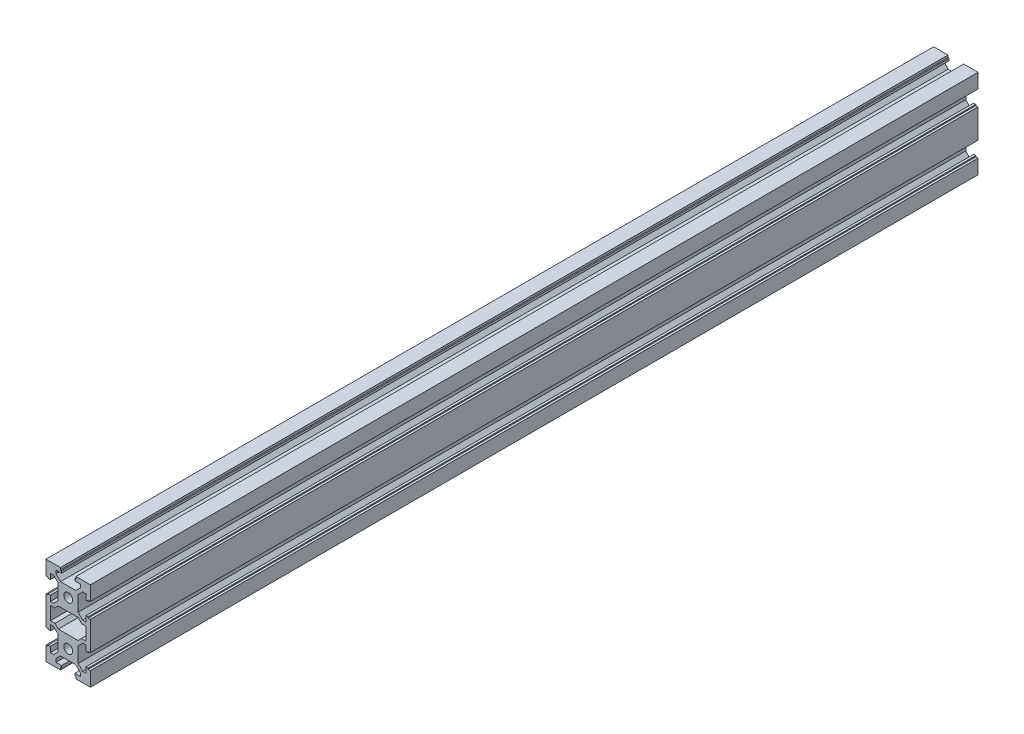
from build123d import *

# Parameters (mm, degrees)
SKETCH1_R           = 2
BOSS_EXTRUDE1_DEPTH = 400


with BuildPart() as part:
    # Sketch1 → Boss-Extrude1 (new body)
    with BuildSketch(Plane.XY):
        Polygon((-10, -20), (-3.5, -20), (-3.5, -19), (-3, -19), (-3, -18), (-5.5, -18), (-5.5, -16.560660172), (-3.44, -14.500660172), (3.44, -14.500660172), (5.5, -16.560660172), (5.5, -18), (3, -18), (3, -19), (3.5, -19), (3.5, -20), (10, -20), (10, -13.5), (9, -13.5), (9, -13), (8, -13), (8, -15.5), (6.560660172, -15.5), (4.500660172, -13.44), (4.500660172, -6.56), (6.560660172, -4.5), (8, -4.5), (8, -7), (9, -7), (9, -6.5), (10, -6.5), (10, 6.5), (9, 6.5), (9, 7), (8, 7), (8, 4.5), (6.560660172, 4.5), (4.500660172, 6.56), (4.500660172, 13.44), (6.560660172, 15.5), (8, 15.5), (8, 13), (9, 13), (9, 13.5), (10, 13.5), (10, 20), (3.5, 20), (3.5, 19), (3, 19), (3, 18), (5.5, 18), (5.5, 16.560660172), (3.44, 14.500660172), (-3.44, 14.500660172), (-5.5, 16.560660172), (-5.5, 18), (-3, 18), (-3, 19), (-3.5, 19), (-3.5, 20), (-10, 20), (-10, 13.5), (-9, 13.5), (-9, 13), (-8, 13), (-8, 15.5), (-6.560660172, 15.5), (-4.500660172, 13.44), (-4.500660172, 6.56), (-6.560660172, 4.5), (-8, 4.5), (-8, 7), (-9, 7), (-9, 6.5), (-10, 6.5), (-10, -6.5), (-9, -6.5), (-9, -7), (-8, -7), (-8, -4.5), (-6.560660172, -4.5), (-4.500660172, -6.56), (-4.500660172, -13.44), (-6.560660172, -15.5), (-8, -15.5), (-8, -13), (-9, -13), (-9, -13.5), (-10, -13.5), align=None)
        with Locations((0, 10)):
            Circle(SKETCH1_R, mode=Mode.SUBTRACT)
        with Locations((0, -10)):
            Circle(SKETCH1_R, mode=Mode.SUBTRACT)
        Polygon((-4.439339828, 4.5), (4.439339828, 4.5), (6.103256126, 2.836083702), (8, 2.836083702), (8, -2.999669914), (5.939669914, -2.999669914), (4.44, -4.499339828), (-4.44, -4.499339828), (-5.939669914, -2.999669914), (-8, -2.999669914), (-8, 3.000330086), (-5.939009742, 3.000330086), align=None, mode=Mode.SUBTRACT)
    extrude(amount=BOSS_EXTRUDE1_DEPTH)


solid = part.part
